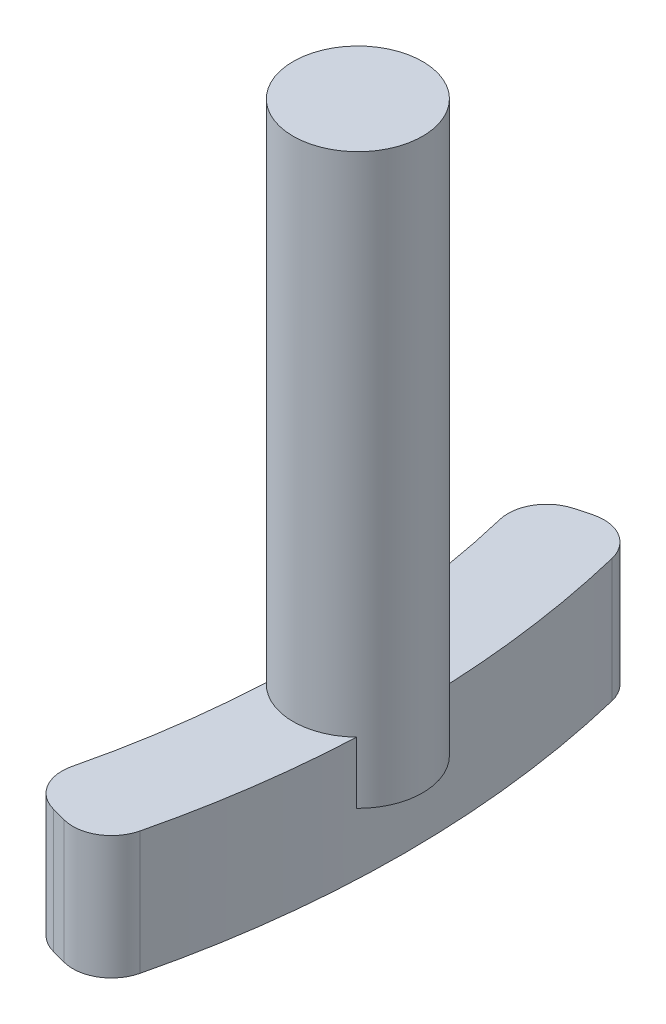
from build123d import *

# Parameters (mm, degrees)
EXTRUDE_1_DEPTH = 4
SKETCH_2_R      = 2.1
EXTRUDE_2_DEPTH = 18.44


with BuildPart() as part:
    # Эскиз1 → Бобышка-Вытянуть1 (new body)
    with BuildSketch(Plane(origin=(0, 0, 0), x_dir=(1, 0, 0), z_dir=(0, 1, 0))):
        with BuildLine():
            Line((-1.004775086, -8.439280951), (-0.521670756, -8.568728366))
            ThreePointArc((-0.521670756, -8.568728366), (0.439799359, -8.436274341), (1.016677121, -7.655773926))
            ThreePointArc((1.016677121, -7.655773926), (1.93125128, 0), (1.016677121, 7.655773926))
            ThreePointArc((1.016677121, 7.655773926), (0.439799359, 8.436274341), (-0.521670756, 8.568728366))
            Line((-0.521670756, 8.568728366), (-1.004775086, 8.439280951))
            ThreePointArc((-1.004775086, 8.439280951), (-1.756080004, 7.870029772), (-1.8961902, 6.937895063))
            ThreePointArc((-1.8961902, 6.937895063), (-1.06874872, 0), (-1.8961902, -6.937895063))
            ThreePointArc((-1.8961902, -6.937895063), (-1.756080004, -7.870029772), (-1.004775086, -8.439280951))
        make_face()
    extrude(amount=EXTRUDE_1_DEPTH)

    # Эскиз2 → Бобышка-Вытянуть2 (add)
    with BuildSketch(Plane(origin=(0, 2, 0), x_dir=(1, 0, 0), z_dir=(0, 1, 0))):
        with Locations(Location((0.43125128, 0, 0), (0, 0, 45.757566992))):
            Circle(SKETCH_2_R)
    extrude(amount=EXTRUDE_2_DEPTH)


solid = part.part
